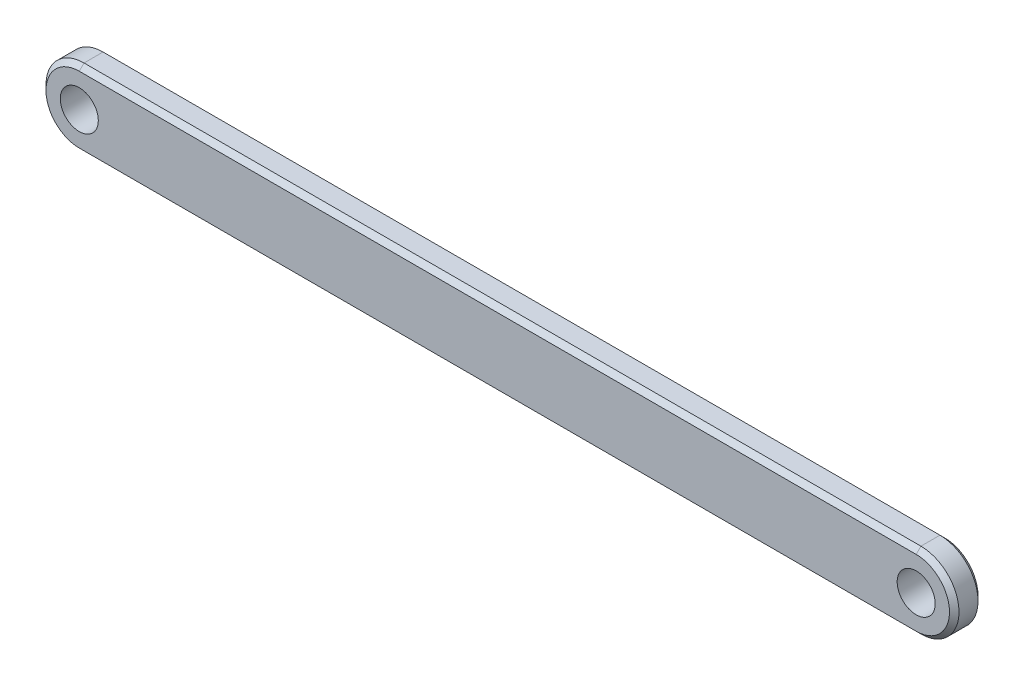
from build123d import *

# Parameters (mm, degrees)
SKETCH1_R           = 2
BOSS_EXTRUDE1_DEPTH = 1.5
CHAMFER1_SIZE       = 0.5


with BuildPart() as part:
    # Sketch1 → Boss-Extrude1 (new, symmetric)
    with BuildSketch(Plane.XY):
        with BuildLine():
            Line((-44, 4), (44, 4))
            ThreePointArc((44, 4), (48, 0), (44, -4))
            Line((44, -4), (-44, -4))
            ThreePointArc((-44, -4), (-48, 0), (-44, 4))
        make_face()
        with Locations((-44, 0)):
            Circle(SKETCH1_R, mode=Mode.SUBTRACT)
        with Locations((44, 0)):
            Circle(SKETCH1_R, mode=Mode.SUBTRACT)
    extrude(amount=BOSS_EXTRUDE1_DEPTH, both=True)

    # Chamfer1
    chamfer1_edges = [part.edges().sort_by_distance(p)[0] for p in [
        (48, 0, 1.5),
        (0, 4, 1.5),
        (-48, 0, 1.5),
        (0, 4, -1.5),
        (48, 0, -1.5),
        (0, -4, -1.5),
        (-48, 0, -1.5),
        (0, -4, 1.5),
    ]]
    chamfer(chamfer1_edges, length=CHAMFER1_SIZE)


solid = part.part
